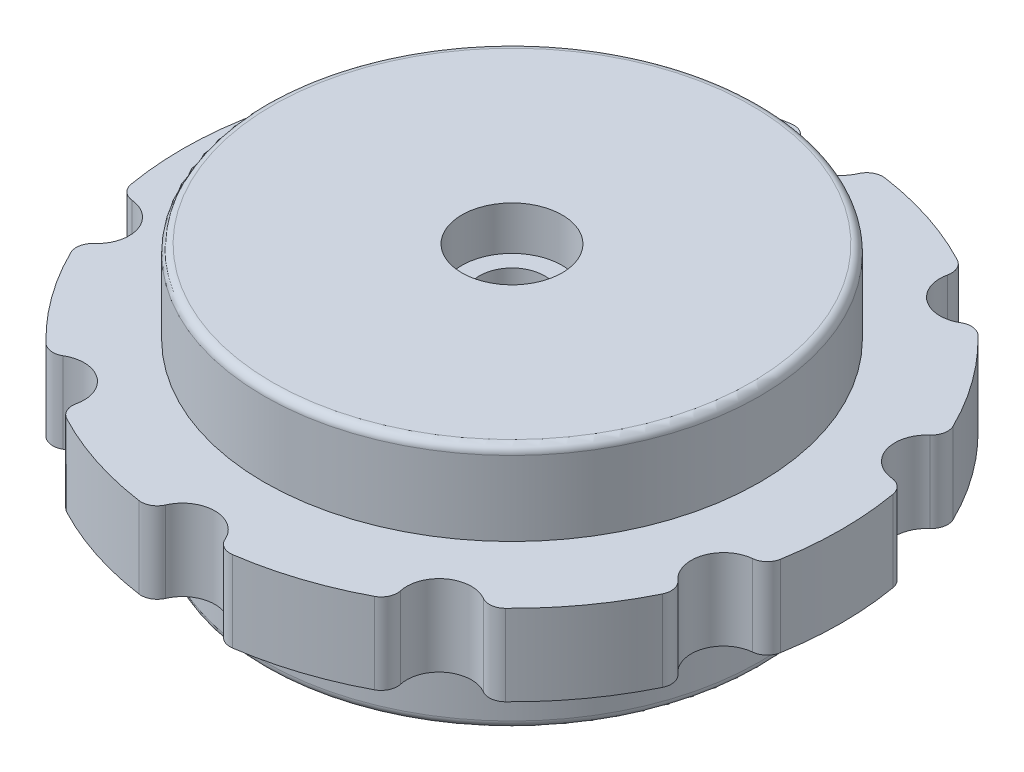
from build123d import *

# Parameters (mm, degrees)
SKETCH_1_R                       = 15.3
SKETCH_1_R_2                     = 13.7
EXTRUDE_1_DEPTH                  = 7.6
SKETCH_1_3_R                     = 20.35
EXTRUDE_2_DEPTH                  = 2.5
SKETCH_1_4_R                     = 2
CUT_EXTRUDE_1_DEPTH              = 30.765836121
FILLET_1_R                       = 1
PATTERN_CIRCULAR_1_COUNT         = 10
FILLET_1_OF_PATTERN_CIRCULAR_1_R = 1
FILLET_2_R                       = 0.5
SKETCH_1_5_R                     = 13.7
EXTRUDE_3_DEPTH                  = 3.9
EXTRUDE_START                    = -7.6
SKETCH_1_6_R                     = 13.7
EXTRUDE_5_DEPTH                  = 15.2
SKETCH_4_R                       = 2
CUT_EXTRUDE_3_DEPTH              = 33.42412133
SKETCH_4_3_R                     = 3.1
CUT_EXTRUDE_4_DEPTH              = 2.7
CUT_EXTRUDE_START                = -12.5
SKETCH_4_4_R                     = 3.1
CUT_EXTRUDE_5_DEPTH              = 2.7


with BuildPart() as part:
    # 草图1 → 凸台-拉伸1 (new, symmetric)
    with BuildSketch(Plane(origin=(0, 0, 0), x_dir=(1, 0, 0), z_dir=(0, 1, 0))):
        with Locations(Location((0, 0, 0), (0, 0, 90))):
            Circle(SKETCH_1_R)
        with Locations(Location((0, 0, 0), (0, 0, 90))):
            Circle(SKETCH_1_R_2, mode=Mode.SUBTRACT)
    extrude(amount=EXTRUDE_1_DEPTH, both=True)

    # 草图1<3> → 凸台-拉伸2 (add, symmetric)
    with BuildSketch(Plane(origin=(0, 0, 0), x_dir=(1, 0, 0), z_dir=(0, 1, 0))):
        with Locations(Location((0, 0, 0), (0, 0, 270))):
            Circle(SKETCH_1_3_R)
    extrude(amount=EXTRUDE_2_DEPTH, both=True)

    # 草图1<4> → 切除-拉伸1 (cut, symmetric)
    with BuildSketch(Plane(origin=(0, 0, 0), x_dir=(1, 0, 0), z_dir=(0, 1, 0))):
        with Locations((0, 20.35)):
            Circle(SKETCH_1_4_R)
    cut_extrude_1 = extrude(amount=CUT_EXTRUDE_1_DEPTH, both=True, mode=Mode.SUBTRACT)

    # 圆角1
    fillet_1_edges = [part.edges().sort_by_distance(p)[0] for p in [
        (-1.997583796, 0, -20.251719902),
        (1.997583796, 0, -20.251719902),
    ]]
    fillet(fillet_1_edges, radius=FILLET_1_R)

    # 阵列(圆周)1: 切除-拉伸1 ×10 about axis
    pattern_circular_1_axis = Axis((0, 0, 0), (0, 1, 0))
    for i in range(1, PATTERN_CIRCULAR_1_COUNT):
        add(cut_extrude_1.rotate(pattern_circular_1_axis, i * 360 / PATTERN_CIRCULAR_1_COUNT), mode=Mode.SUBTRACT)

    # 圆角1 of 阵列(圆周)1
    fillet_1_of_pattern_circular_1_edges = [part.edges().sort_by_distance(p)[0] for p in [
        (-13.51974153, 0, -15.20983527),
        (-10.287583053, 0, -17.558135861),
        (-19.877817519, 0, -4.358310529),
        (-18.643242838, 0, -8.157940701),
        (-18.643242838, 0, 8.157940701),
        (-19.877817519, 0, 4.358310529),
        (-10.287583053, 0, 17.558135861),
        (-13.51974153, 0, 15.20983527),
        (1.997583796, 0, 20.251719902),
        (-1.997583796, 0, 20.251719902),
        (13.51974153, 0, 15.20983527),
        (10.287583053, 0, 17.558135861),
        (19.877817519, 0, 4.358310529),
        (18.643242838, 0, 8.157940701),
        (18.643242838, 0, -8.157940701),
        (19.877817519, 0, -4.358310529),
        (10.287583053, 0, -17.558135861),
        (13.51974153, 0, -15.20983527),
    ]]
    fillet(fillet_1_of_pattern_circular_1_edges, radius=FILLET_1_OF_PATTERN_CIRCULAR_1_R)

    # 圆角2
    fillet_2_edges = [part.edges().sort_by_distance(p)[0] for p in [
        (0, -7.6, 15.3),
        (0, 7.6, 15.3),
    ]]
    fillet(fillet_2_edges, radius=FILLET_2_R)

    # 草图1<5> → 凸台-拉伸3 (add, symmetric)
    with BuildSketch(Plane(origin=(0, 0, 0), x_dir=(1, 0, 0), z_dir=(0, 1, 0))):
        with Locations(Location((0, 0, 0), (0, 0, 90))):
            Circle(SKETCH_1_5_R)
    extrude(amount=EXTRUDE_3_DEPTH, both=True)

    # 草图1<6> → 凸台-拉伸5 (add)
    with BuildSketch(Plane(origin=(0, 0, 0), x_dir=(1, 0, 0), z_dir=(0, 1, 0)).offset(EXTRUDE_START)):
        Circle(SKETCH_1_6_R)
    extrude(amount=EXTRUDE_5_DEPTH)

    # 草图4 → 切除-拉伸3 (cut, through all)
    with BuildSketch(Plane.XZ.offset(7.6)):
        with Locations(Location((0, 0, 0), (0, 0, 270))):
            Circle(SKETCH_4_R)
    extrude(amount=-CUT_EXTRUDE_3_DEPTH, mode=Mode.SUBTRACT)

    # 草图4<3> → 切除-拉伸4 (cut)
    with BuildSketch(Plane.XZ.offset(7.6)):
        with Locations(Location((0, 0, 0), (0, 0, 270))):
            Circle(SKETCH_4_3_R)
    extrude(amount=-CUT_EXTRUDE_4_DEPTH, mode=Mode.SUBTRACT)

    # 草图4<4> → 切除-拉伸5 (cut)
    with BuildSketch(Plane.XZ.offset(7.6).offset(CUT_EXTRUDE_START)):
        with Locations(Location((0, 0, 0), (0, 0, 270))):
            Circle(SKETCH_4_4_R)
    extrude(amount=-CUT_EXTRUDE_5_DEPTH, mode=Mode.SUBTRACT)


solid = part.part
